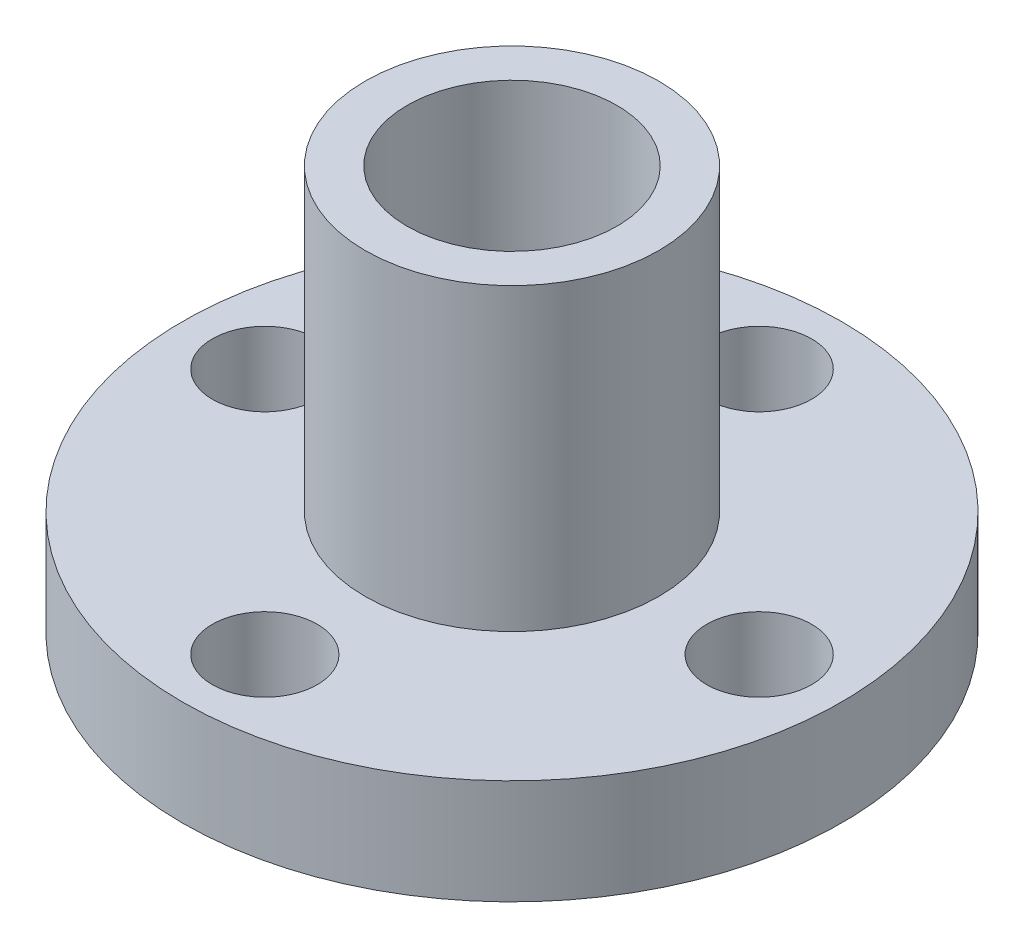
from build123d import *

# Parameters (mm, degrees)
CROQUIS1_R              = 11
CROQUIS1_R_2            = 3.5
CROQUIS1_R_3            = 1.75
SALIENTE_EXTRUIR1_DEPTH = 3.5
CROQUIS2_R              = 4.9
CROQUIS2_R_2            = 3.5
SALIENTE_EXTRUIR2_DEPTH = 10


with BuildPart() as part:
    # Croquis1 → Saliente-Extruir1 (new body)
    with BuildSketch(Plane(origin=(0, 0, 0), x_dir=(1, 0, 0), z_dir=(0, 1, 0))):
        with Locations(Location((0, 0, 0), (0, 0, 270))):
            Circle(CROQUIS1_R)
        with Locations(Location((0, 0, 0), (0, 0, 270))):
            Circle(CROQUIS1_R_2, mode=Mode.SUBTRACT)
        with Locations(Location((8.25, 0, 0), (0, 0, 270))):
            Circle(CROQUIS1_R_3, mode=Mode.SUBTRACT)
        with Locations(Location((0, 8.25, 0), (0, 0, 270))):
            Circle(CROQUIS1_R_3, mode=Mode.SUBTRACT)
        with Locations(Location((-8.25, 0, 0), (0, 0, 270))):
            Circle(CROQUIS1_R_3, mode=Mode.SUBTRACT)
        with Locations(Location((0, -8.25, 0), (0, 0, 270))):
            Circle(CROQUIS1_R_3, mode=Mode.SUBTRACT)
    extrude(amount=SALIENTE_EXTRUIR1_DEPTH)

    # Croquis2 → Saliente-Extruir2 (add)
    with BuildSketch(Plane(origin=(0, 3.5, 0), x_dir=(1, 0, 0), z_dir=(0, 1, 0))):
        with Locations(Location((0, 0, 0), (0, 0, 270))):
            Circle(CROQUIS2_R)
        with Locations(Location((0, 0, 0), (0, 0, 270))):
            Circle(CROQUIS2_R_2, mode=Mode.SUBTRACT)
    extrude(amount=SALIENTE_EXTRUIR2_DEPTH)


solid = part.part
